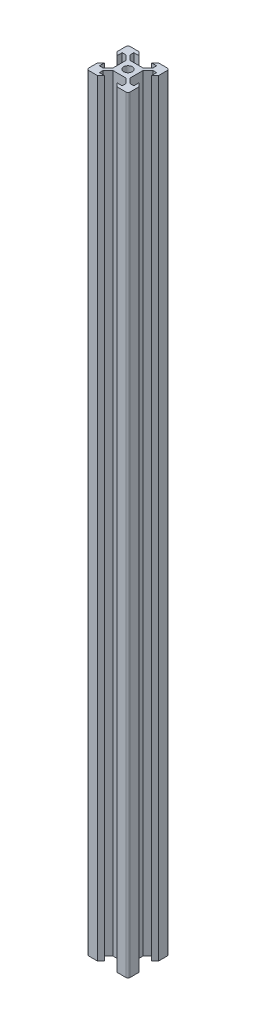
from build123d import *

# Parameters (mm, degrees)
MASTERLAYOUTSKETCH_R = 2.1
MAIN_EXTRUSION_DEPTH = 370
EDGE_FILLETS_R       = 1


with BuildPart() as part:
    # MasterLayoutSketch → Main Extrusion (new body)
    with BuildSketch(Plane(origin=(0, 0, 0), x_dir=(1, 0, 0), z_dir=(0, 1, 0))):
        Polygon((-8.325, 3.1), (-8.325, 5.5), (-6.560660172, 5.5), (-4.160660172, 3.1), (-4.160660172, -3.1), (-6.560660172, -5.5), (-8.325, -5.5), (-8.325, -3.1), (-10, -4.775), (-10, -10), (-4.775, -10), (-3.1, -8.325), (-5.5, -8.325), (-5.5, -6.560660172), (-3.1, -4.160660172), (3.1, -4.160660172), (5.5, -6.560660172), (5.5, -8.325), (3.1, -8.325), (4.775, -10), (10, -10), (10, -4.775), (8.325, -3.1), (8.325, -5.5), (6.560660172, -5.5), (4.160660172, -3.1), (4.160660172, 3.1), (6.560660172, 5.5), (8.325, 5.5), (8.325, 3.1), (10, 4.775), (10, 10), (4.775, 10), (3.1, 8.325), (5.5, 8.325), (5.5, 6.560660172), (3.1, 4.160660172), (-3.1, 4.160660172), (-5.5, 6.560660172), (-5.5, 8.325), (-3.1, 8.325), (-4.775, 10), (-10, 10), (-10, 4.775), align=None)
        with Locations(Location((0, 0, 0), (0, 0, 270))):
            Circle(MASTERLAYOUTSKETCH_R, mode=Mode.SUBTRACT)
    extrude(amount=MAIN_EXTRUSION_DEPTH)

    # Edge Fillets
    edge_fillets_edges = [part.edges().sort_by_distance(p)[0] for p in [
        (10, 185, -10),
        (10, 185, 10),
        (-10, 185, 10),
        (-10, 185, -10),
    ]]
    fillet(edge_fillets_edges, radius=EDGE_FILLETS_R)


solid = part.part
